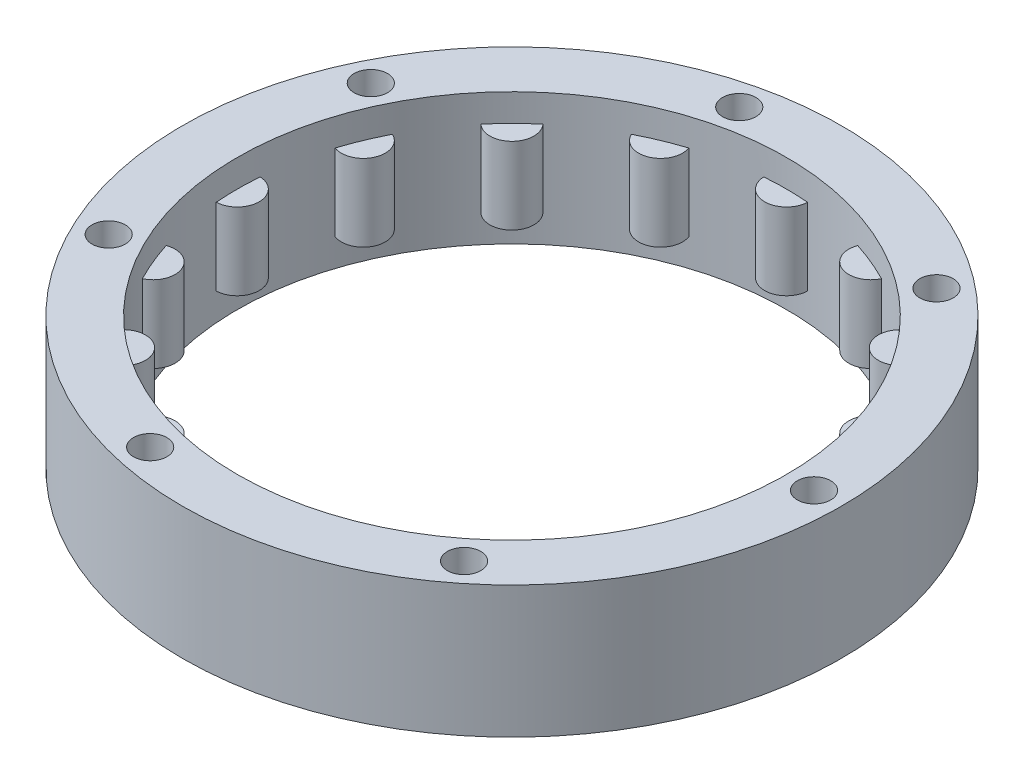
from build123d import *

# Parameters (mm, degrees)
CROQUIS1_R                 = 2
SALIENTE_EXTRUIR1_DEPTH    = 3.5
SALIENTE_EXTRUIR1_2_DEPTH  = 3.5
SALIENTE_EXTRUIR1_3_DEPTH  = 3.5
SALIENTE_EXTRUIR1_4_DEPTH  = 3.5
SALIENTE_EXTRUIR1_5_DEPTH  = 3.5
SALIENTE_EXTRUIR1_6_DEPTH  = 3.5
SALIENTE_EXTRUIR1_7_DEPTH  = 3.5
SALIENTE_EXTRUIR1_8_DEPTH  = 3.5
SALIENTE_EXTRUIR1_9_DEPTH  = 3.5
SALIENTE_EXTRUIR1_10_DEPTH = 3.5
SALIENTE_EXTRUIR1_11_DEPTH = 3.5
SALIENTE_EXTRUIR1_12_DEPTH = 3.5
SALIENTE_EXTRUIR1_13_DEPTH = 3.5
SALIENTE_EXTRUIR1_14_DEPTH = 3.5
SALIENTE_EXTRUIR1_15_DEPTH = 3.5
SALIENTE_EXTRUIR1_16_DEPTH = 3.5
CROQUIS3_R                 = 30
CROQUIS3_R_2               = 25
SALIENTE_EXTRUIR2_DEPTH    = 6
CROQUIS4_R                 = 1.52
CORTAR_EXTRUIR1_DEPTH      = 45.09081537


with BuildPart() as part:
    # Croquis1 → Saliente-Extruir1 (new, symmetric)
    with BuildSketch(Plane(origin=(0, 0, 0), x_dir=(1, 0, 0), z_dir=(0, 1, 0))):
        with Locations(Location((25, 0, 0), (0, 0, 270))):
            Circle(CROQUIS1_R)
    extrude(amount=SALIENTE_EXTRUIR1_DEPTH, both=True)



with BuildPart() as body_2:
    # Croquis1 → Saliente-Extruir1 2 (new, symmetric)
    with BuildSketch(Plane(origin=(0, 0, 0), x_dir=(1, 0, 0), z_dir=(0, 1, 0))):
        with Locations(Location((23.096988313, -9.567085809, 0), (0, 0, 270))):
            Circle(CROQUIS1_R)
    extrude(amount=SALIENTE_EXTRUIR1_2_DEPTH, both=True)


with BuildPart() as body_3:
    # Croquis1 → Saliente-Extruir1 3 (new, symmetric)
    with BuildSketch(Plane(origin=(0, 0, 0), x_dir=(1, 0, 0), z_dir=(0, 1, 0))):
        with Locations(Location((17.67766953, -17.67766953, 0), (0, 0, 270))):
            Circle(CROQUIS1_R)
    extrude(amount=SALIENTE_EXTRUIR1_3_DEPTH, both=True)


with BuildPart() as body_4:
    # Croquis1 → Saliente-Extruir1 4 (new, symmetric)
    with BuildSketch(Plane(origin=(0, 0, 0), x_dir=(1, 0, 0), z_dir=(0, 1, 0))):
        with Locations(Location((9.567085809, -23.096988313, 0), (0, 0, 270))):
            Circle(CROQUIS1_R)
    extrude(amount=SALIENTE_EXTRUIR1_4_DEPTH, both=True)


with BuildPart() as body_5:
    # Croquis1 → Saliente-Extruir1 5 (new, symmetric)
    with BuildSketch(Plane(origin=(0, 0, 0), x_dir=(1, 0, 0), z_dir=(0, 1, 0))):
        with Locations(Location((0, -25, 0), (0, 0, 270))):
            Circle(CROQUIS1_R)
    extrude(amount=SALIENTE_EXTRUIR1_5_DEPTH, both=True)


with BuildPart() as body_6:
    # Croquis1 → Saliente-Extruir1 6 (new, symmetric)
    with BuildSketch(Plane(origin=(0, 0, 0), x_dir=(1, 0, 0), z_dir=(0, 1, 0))):
        with Locations(Location((-9.567085809, -23.096988313, 0), (0, 0, 270))):
            Circle(CROQUIS1_R)
    extrude(amount=SALIENTE_EXTRUIR1_6_DEPTH, both=True)


with BuildPart() as body_7:
    # Croquis1 → Saliente-Extruir1 7 (new, symmetric)
    with BuildSketch(Plane(origin=(0, 0, 0), x_dir=(1, 0, 0), z_dir=(0, 1, 0))):
        with Locations(Location((-17.67766953, -17.67766953, 0), (0, 0, 270))):
            Circle(CROQUIS1_R)
    extrude(amount=SALIENTE_EXTRUIR1_7_DEPTH, both=True)


with BuildPart() as body_8:
    # Croquis1 → Saliente-Extruir1 8 (new, symmetric)
    with BuildSketch(Plane(origin=(0, 0, 0), x_dir=(1, 0, 0), z_dir=(0, 1, 0))):
        with Locations(Location((-23.096988313, -9.567085809, 0), (0, 0, 270))):
            Circle(CROQUIS1_R)
    extrude(amount=SALIENTE_EXTRUIR1_8_DEPTH, both=True)


with BuildPart() as body_9:
    # Croquis1 → Saliente-Extruir1 9 (new, symmetric)
    with BuildSketch(Plane(origin=(0, 0, 0), x_dir=(1, 0, 0), z_dir=(0, 1, 0))):
        with Locations(Location((-25, 0, 0), (0, 0, 270))):
            Circle(CROQUIS1_R)
    extrude(amount=SALIENTE_EXTRUIR1_9_DEPTH, both=True)


with BuildPart() as body_10:
    # Croquis1 → Saliente-Extruir1 10 (new, symmetric)
    with BuildSketch(Plane(origin=(0, 0, 0), x_dir=(1, 0, 0), z_dir=(0, 1, 0))):
        with Locations(Location((-23.096988313, 9.567085809, 0), (0, 0, 270))):
            Circle(CROQUIS1_R)
    extrude(amount=SALIENTE_EXTRUIR1_10_DEPTH, both=True)


with BuildPart() as body_11:
    # Croquis1 → Saliente-Extruir1 11 (new, symmetric)
    with BuildSketch(Plane(origin=(0, 0, 0), x_dir=(1, 0, 0), z_dir=(0, 1, 0))):
        with Locations(Location((-17.67766953, 17.67766953, 0), (0, 0, 270))):
            Circle(CROQUIS1_R)
    extrude(amount=SALIENTE_EXTRUIR1_11_DEPTH, both=True)


with BuildPart() as body_12:
    # Croquis1 → Saliente-Extruir1 12 (new, symmetric)
    with BuildSketch(Plane(origin=(0, 0, 0), x_dir=(1, 0, 0), z_dir=(0, 1, 0))):
        with Locations(Location((-9.567085809, 23.096988313, 0), (0, 0, 270))):
            Circle(CROQUIS1_R)
    extrude(amount=SALIENTE_EXTRUIR1_12_DEPTH, both=True)


with BuildPart() as body_13:
    # Croquis1 → Saliente-Extruir1 13 (new, symmetric)
    with BuildSketch(Plane(origin=(0, 0, 0), x_dir=(1, 0, 0), z_dir=(0, 1, 0))):
        with Locations(Location((0, 25, 0), (0, 0, 270))):
            Circle(CROQUIS1_R)
    extrude(amount=SALIENTE_EXTRUIR1_13_DEPTH, both=True)


with BuildPart() as body_14:
    # Croquis1 → Saliente-Extruir1 14 (new, symmetric)
    with BuildSketch(Plane(origin=(0, 0, 0), x_dir=(1, 0, 0), z_dir=(0, 1, 0))):
        with Locations(Location((9.567085809, 23.096988313, 0), (0, 0, 270))):
            Circle(CROQUIS1_R)
    extrude(amount=SALIENTE_EXTRUIR1_14_DEPTH, both=True)


with BuildPart() as body_15:
    # Croquis1 → Saliente-Extruir1 15 (new, symmetric)
    with BuildSketch(Plane(origin=(0, 0, 0), x_dir=(1, 0, 0), z_dir=(0, 1, 0))):
        with Locations(Location((17.67766953, 17.67766953, 0), (0, 0, 270))):
            Circle(CROQUIS1_R)
    extrude(amount=SALIENTE_EXTRUIR1_15_DEPTH, both=True)


with BuildPart() as body_16:
    # Croquis1 → Saliente-Extruir1 16 (new, symmetric)
    with BuildSketch(Plane(origin=(0, 0, 0), x_dir=(1, 0, 0), z_dir=(0, 1, 0))):
        with Locations(Location((23.096988313, 9.567085809, 0), (0, 0, 270))):
            Circle(CROQUIS1_R)
    extrude(amount=SALIENTE_EXTRUIR1_16_DEPTH, both=True)


with BuildPart() as part_1:
    add(part.part)

    add(body_2.part)  # Saliente-Extruir2 merges body 2

    add(body_3.part)  # Saliente-Extruir2 merges body 3

    add(body_4.part)  # Saliente-Extruir2 merges body 4

    add(body_5.part)  # Saliente-Extruir2 merges body 5

    add(body_6.part)  # Saliente-Extruir2 merges body 6

    add(body_7.part)  # Saliente-Extruir2 merges body 7

    add(body_8.part)  # Saliente-Extruir2 merges body 8

    add(body_9.part)  # Saliente-Extruir2 merges body 9

    add(body_10.part)  # Saliente-Extruir2 merges body 10

    add(body_11.part)  # Saliente-Extruir2 merges body 11

    add(body_12.part)  # Saliente-Extruir2 merges body 12

    add(body_13.part)  # Saliente-Extruir2 merges body 13

    add(body_14.part)  # Saliente-Extruir2 merges body 14

    add(body_15.part)  # Saliente-Extruir2 merges body 15

    add(body_16.part)  # Saliente-Extruir2 merges body 16
    # Croquis3 → Saliente-Extruir2 (add, symmetric)
    with BuildSketch(Plane(origin=(0, 0, 0), x_dir=(1, 0, 0), z_dir=(0, 1, 0))):
        with Locations(Location((0, 0, 0), (0, 0, 270))):
            Circle(CROQUIS3_R)
        with Locations(Location((0, 0, 0), (0, 0, 270))):
            Circle(CROQUIS3_R_2, mode=Mode.SUBTRACT)
    extrude(amount=SALIENTE_EXTRUIR2_DEPTH, both=True)

    # Croquis4 → Cortar-Extruir1 (cut, through all)
    with BuildSketch(Plane(origin=(0, 6, 0), x_dir=(1, 0, 0), z_dir=(0, 1, 0))):
        with Locations(Location((27.5, 0, 0), (0, 0, 270))):
            Circle(CROQUIS4_R)
        with Locations(Location((17.145969551, -21.500365768, 0), (0, 0, 270))):
            Circle(CROQUIS4_R)
        with Locations(Location((-6.119325684, -26.810517585, 0), (0, 0, 270))):
            Circle(CROQUIS4_R)
        with Locations(Location((-24.776643867, -11.931802826, 0), (0, 0, 270))):
            Circle(CROQUIS4_R)
        with Locations(Location((-24.776643867, 11.931802826, 0), (0, 0, 270))):
            Circle(CROQUIS4_R)
        with Locations(Location((-6.119325684, 26.810517585, 0), (0, 0, 270))):
            Circle(CROQUIS4_R)
        with Locations(Location((17.145969551, 21.500365768, 0), (0, 0, 270))):
            Circle(CROQUIS4_R)
    extrude(amount=-CORTAR_EXTRUIR1_DEPTH, mode=Mode.SUBTRACT)


solid = part_1.part
